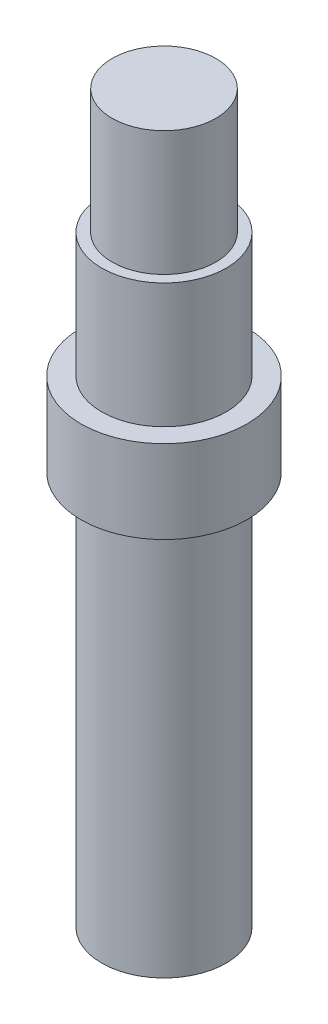
from build123d import *

# Parameters (mm, degrees)
SKETCH_1_R      = 6
EXTRUDE_1_DEPTH = 38
SKETCH_2_R      = 8
EXTRUDE_2_DEPTH = 8
SKETCH_4_R      = 6
EXTRUDE_3_DEPTH = 12
SKETCH_5_R      = 5
EXTRUDE_4_DEPTH = 12


with BuildPart() as part:
    # 草图1 → 凸台-拉伸1 (new body)
    with BuildSketch(Plane(origin=(0, 0, 0), x_dir=(1, 0, 0), z_dir=(0, 1, 0))):
        with Locations(Location((0, 0, 0), (0, 0, 270))):
            Circle(SKETCH_1_R)
    extrude(amount=EXTRUDE_1_DEPTH)

    # 草图2 → 凸台-拉伸2 (add)
    with BuildSketch(Plane(origin=(0, 38, 0), x_dir=(1, 0, 0), z_dir=(0, 1, 0))):
        with Locations(Location((0, 0, 0), (0, 0, 270))):
            Circle(SKETCH_2_R)
    extrude(amount=EXTRUDE_2_DEPTH)

    # 草图4 → 凸台-拉伸3 (add)
    with BuildSketch(Plane(origin=(0, 46, 0), x_dir=(1, 0, 0), z_dir=(0, 1, 0))):
        with Locations(Location((0, 0, 0), (0, 0, 270))):
            Circle(SKETCH_4_R)
    extrude(amount=EXTRUDE_3_DEPTH)

    # 草图5 → 凸台-拉伸4 (add)
    with BuildSketch(Plane(origin=(0, 58, 0), x_dir=(1, 0, 0), z_dir=(0, 1, 0))):
        with Locations(Location((0, 0, 0), (0, 0, 270))):
            Circle(SKETCH_5_R)
    extrude(amount=EXTRUDE_4_DEPTH)


solid = part.part
